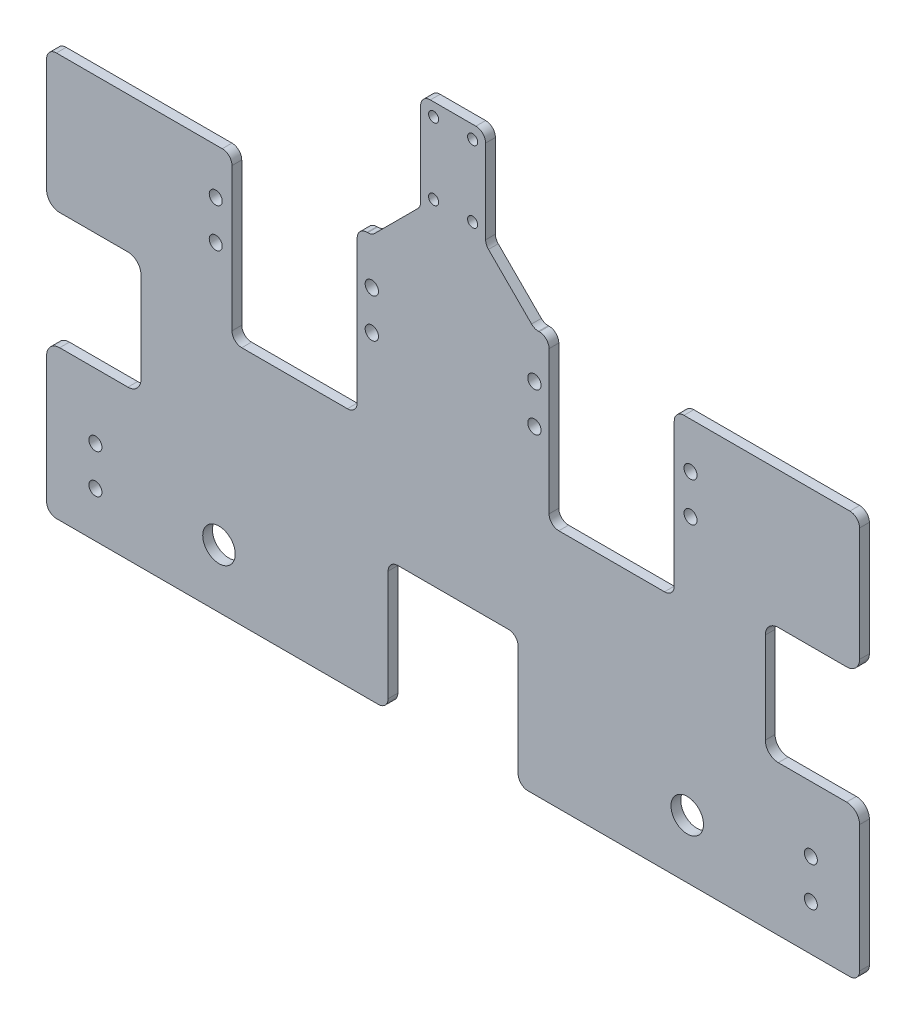
from build123d import *

# Parameters (mm, degrees)
EXTRUDE_1_DEPTH     = 3
SKETCH_2_R          = 1.55
CUT_EXTRUDE_1_DEPTH = 92.050809991
SKETCH_3_R          = 2.05
CUT_EXTRUDE_2_DEPTH = 92.050809991
SKETCH_4_W          = 3
SKETCH_4_H          = 40.476527492
CUT_EXTRUDE_3_DEPTH = 10
EXTRUDE_2_DEPTH     = 3
SKETCH_6_W          = 20
SKETCH_6_H          = 40
CUT_EXTRUDE_4_DEPTH = 4
FILLET_1_R          = 3
SKETCH_7_R          = 5
SKETCH_7_W          = 31
SKETCH_7_H          = 36
CUT_EXTRUDE_5_DEPTH = 4
SKETCH_8_R          = 2
CUT_EXTRUDE_6_DEPTH = 4
SKETCH_9_R          = 2
CUT_EXTRUDE_7_DEPTH = 4
FILLET_2_R          = 4


with BuildPart() as part:
    # 草图1 → 凸台-拉伸1 (new body)
    with BuildSketch(Plane.XY):
        Polygon((-32.5, 40), (-25, 40), (-10, 55), (-10, 85), (10, 85), (10, 55), (25, 40), (32.5, 40), (32.5, 0), (-32.5, 0), align=None)
    extrude(amount=EXTRUDE_1_DEPTH)

    # 草图2 → 切除-拉伸1 (cut, through all)
    with BuildSketch(Plane.XY.offset(3)):
        with Locations((-6, 81)):
            Circle(SKETCH_2_R)
        with Locations(Location((-6, 59, 0), (0, 0, 180))):
            Circle(SKETCH_2_R)
        with Locations((6, 59)):
            Circle(SKETCH_2_R)
        with Locations(Location((6, 81, 0), (0, 0, 180))):
            Circle(SKETCH_2_R)
    extrude(amount=-CUT_EXTRUDE_1_DEPTH, mode=Mode.SUBTRACT)

    # 草图3 → 切除-拉伸2 (cut, through all)
    with BuildSketch(Plane.XY.offset(3)):
        with Locations((-25, 26)):
            Circle(SKETCH_3_R)
        with Locations(Location((-25, 14, 0), (0, 0, 180))):
            Circle(SKETCH_3_R)
        with Locations((25, 14)):
            Circle(SKETCH_3_R)
        with Locations(Location((25, 26, 0), (0, 0, 180))):
            Circle(SKETCH_3_R)
    extrude(amount=-CUT_EXTRUDE_2_DEPTH, mode=Mode.SUBTRACT)

    # 草图4 → 切除-拉伸3 (cut)
    with BuildSketch(Plane.XY.offset(3)):
        with Locations((31, 19.761736254)):
            Rectangle(SKETCH_4_W, SKETCH_4_H)
        with Locations((-31, 19.761736254)):
            Rectangle(SKETCH_4_W, SKETCH_4_H)
    extrude(amount=-CUT_EXTRUDE_3_DEPTH, mode=Mode.SUBTRACT)

    # 草图5 → 凸台-拉伸2 (add)
    with BuildSketch(Plane.XY.offset(3)):
        Polygon((-125, 40), (-125, -84), (125, -84), (125, 40), (68, 40), (68, -10), (29.5, -10), (29.5, 0), (-29.5, 0), (-29.5, -10), (-68, -10), (-68, 40), align=None)
    extrude(amount=-EXTRUDE_2_DEPTH)

    # 草图6 → 切除-拉伸4 (cut)
    with BuildSketch(Plane.XY.offset(3)):
        with Locations((10, -64)):
            Rectangle(SKETCH_6_W, SKETCH_6_H)
        with Locations((-10, -64)):
            Rectangle(SKETCH_6_W, SKETCH_6_H)
    extrude(amount=-CUT_EXTRUDE_4_DEPTH, mode=Mode.SUBTRACT)

    # 圆角1
    fillet_1_edges = [part.edges().sort_by_distance(p)[0] for p in [
        (68, -10, 1.5),
        (68, 40, 1.5),
        (125, 40, 1.5),
        (125, -84, 1.5),
        (-125, -84, 1.5),
        (-125, 40, 1.5),
        (-68, 40, 1.5),
        (-68, -10, 1.5),
        (-29.5, -10, 1.5),
        (29.5, -10, 1.5),
        (20, -84, 1.5),
        (-20, -84, 1.5),
        (-20, -44, 1.5),
        (20, -44, 1.5),
        (-25, 40, 1.5),
        (-10, 55, 1.5),
        (-10, 85, 1.5),
        (10, 85, 1.5),
        (10, 55, 1.5),
        (25, 40, 1.5),
        (29.5, 40, 1.5),
        (-29.5, 40, 1.5),
    ]]
    fillet(fillet_1_edges, radius=FILLET_1_R)

    # 草图7 → 切除-拉伸5 (cut)
    with BuildSketch(Plane.XY.offset(3)):
        with Locations((72, -66)):
            Circle(SKETCH_7_R)
        with Locations((-72, -66)):
            Circle(SKETCH_7_R)
        with Locations((111.5, -20)):
            Rectangle(SKETCH_7_W, SKETCH_7_H)
        with Locations((-111.5, -20)):
            Rectangle(SKETCH_7_W, SKETCH_7_H)
    extrude(amount=-CUT_EXTRUDE_5_DEPTH, mode=Mode.SUBTRACT)

    # 草图8 → 切除-拉伸6 (cut)
    with BuildSketch(Plane.XY.offset(3)):
        with Locations((73, 26)):
            Circle(SKETCH_8_R)
        with Locations((73, 14)):
            Circle(SKETCH_8_R)
        with Locations((-73, 14)):
            Circle(SKETCH_8_R)
        with Locations((-73, 26)):
            Circle(SKETCH_8_R)
    extrude(amount=-CUT_EXTRUDE_6_DEPTH, mode=Mode.SUBTRACT)

    # 草图9 → 切除-拉伸7 (cut)
    with BuildSketch(Plane.XY.offset(3)):
        with Locations((110, -58)):
            Circle(SKETCH_9_R)
        with Locations((110, -70)):
            Circle(SKETCH_9_R)
        with Locations((-110, -70)):
            Circle(SKETCH_9_R)
        with Locations((-110, -58)):
            Circle(SKETCH_9_R)
    extrude(amount=-CUT_EXTRUDE_7_DEPTH, mode=Mode.SUBTRACT)

    # 圆角2
    fillet_2_edges = [part.edges().sort_by_distance(p)[0] for p in [
        (-125, -38, 1.5),
        (-125, -2, 1.5),
        (125, -38, 1.5),
        (125, -2, 1.5),
        (-96, -2, 1.5),
        (-96, -38, 1.5),
        (96, -38, 1.5),
        (96, -2, 1.5),
    ]]
    fillet(fillet_2_edges, radius=FILLET_2_R)


solid = part.part
